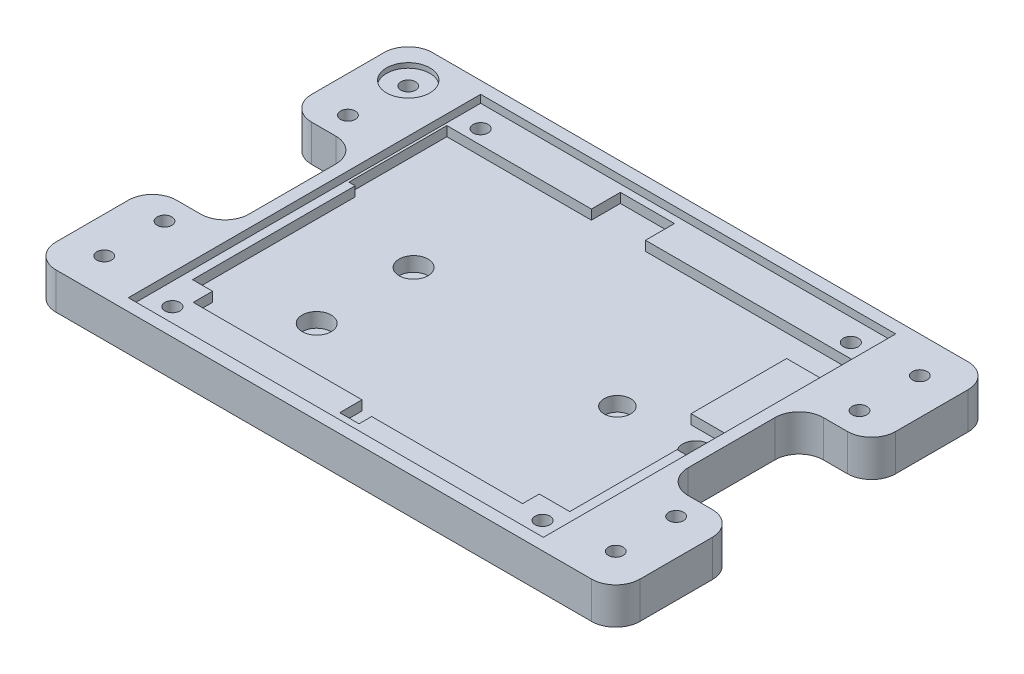
from build123d import *

# Parameters (mm, degrees)
BOSS_EXTRUDE1_DEPTH = 7.6
SKETCH2_5_W         = 85
SKETCH2_5_H         = 72
CUT_EXTRUDE9_DEPTH  = 1.61
CUT_EXTRUDE10_DEPTH = 2
SKETCH2_R           = 1.55
CUT_EXTRUDE3_DEPTH  = 90.547849587
FILLET1_R           = 5
SKETCH5_R           = 1.525
CUT_EXTRUDE4_DEPTH  = 10
SKETCH5_3_R         = 4.5
CUT_EXTRUDE5_DEPTH  = 1
CUT_EXTRUDE6_DEPTH  = 2.4
SKETCH12_R          = 2.75
SKETCH12_R_2        = 3
CUT_EXTRUDE11_DEPTH = 5
SKETCH2_6_W         = 86
SKETCH2_6_H         = 73
CUT_EXTRUDE12_DEPTH = 1.61


with BuildPart() as part:
    # Sketch1 → Boss-Extrude1 (new body)
    with BuildSketch(Plane(origin=(0, 0, 0), x_dir=(1, 0, 0), z_dir=(0, 1, 0))):
        Polygon((-40.307015775, 35.377886591), (-40.307015775, 7.377886591), (-55.307015775, 7.377886591), (-55.307015775, -17.622113409), (-44.307015775, -17.622113409), (45.692984225, -17.622113409), (65.692984225, -17.622113409), (65.692984225, 7.377886591), (50.692984225, 7.377886591), (50.692984225, 35.377886591), (65.692984225, 35.377886591), (65.692984225, 60.377886591), (45.692984225, 60.377886591), (-44.307015775, 60.377886591), (-55.307015775, 60.377886591), (-55.307015775, 35.377886591), align=None)
    extrude(amount=BOSS_EXTRUDE1_DEPTH)

    # Sketch2<5> → Cut-Extrude9 (cut)
    with BuildSketch(Plane(origin=(0, 7.6, 0), x_dir=(1, 0, 0), z_dir=(0, 1, 0))):
        with Locations((5.192984225, 21.377886591)):
            Rectangle(SKETCH2_5_W, SKETCH2_5_H)
    extrude(amount=-CUT_EXTRUDE9_DEPTH, mode=Mode.SUBTRACT)

    # Sketch11 → Cut-Extrude10 (cut)
    with BuildSketch(Plane(origin=(0, 5.99, 0), x_dir=(1, 0, 0), z_dir=(0, 1, 0))):
        Polygon((-35.999166331, 50.377886591), (-7.351072422, 50.377886591), (-7.351072422, 56.377886591), (3.851672568, 56.377886591), (3.851672568, 50.377886591), (47.692984225, 50.377886591), (47.692984225, 43.777886591), (39.692984225, 43.777886591), (39.692984225, 23.977886591), (47.692984225, 23.977886591), (47.692984225, 16.077886591), (44.692984225, 16.077886591), (44.692984225, -6.156199895), (38.382984225, -6.156199895), (38.382984225, -9.622113409), (7.110984225, -9.622113409), (7.110984225, -12.237769432), (3.110984225, -12.237769432), (3.110984225, -7.622113409), (-31.857233389, -7.622113409), (-31.857233389, -3.622113409), (-35.999166331, -3.622113409), (-35.999166331, 30.077886591), (-37.307015775, 30.077886591), (-37.307015775, 50.377886591), align=None)
    extrude(amount=-CUT_EXTRUDE10_DEPTH, mode=Mode.SUBTRACT)

    # Sketch2 → Cut-Extrude3 (cut, through all)
    with BuildSketch(Plane(origin=(0, 7.6, 0), x_dir=(1, 0, 0), z_dir=(0, 1, 0))):
        with Locations((43.464984225, 53.313886591)):
            Circle(SKETCH2_R)
        with Locations((-33.243015775, 53.313886591)):
            Circle(SKETCH2_R)
        with Locations((-33.243015775, -10.558113409)):
            Circle(SKETCH2_R)
        with Locations((43.464984225, -10.558113409)):
            Circle(SKETCH2_R)
    extrude(amount=-CUT_EXTRUDE3_DEPTH, mode=Mode.SUBTRACT)

    # Fillet1
    fillet1_edges = [part.edges().sort_by_distance(p)[0] for p in [
        (-55.307015775, 3.8, -35.377886591),
        (-55.307015775, 3.8, -60.377886591),
        (-55.307015775, 3.8, 17.622113409),
        (65.692984225, 3.8, -60.377886591),
        (50.692984225, 3.8, -35.377886591),
        (65.692984225, 3.8, -35.377886591),
        (65.692984225, 3.8, 17.622113409),
        (-55.307015775, 3.8, -7.377886591),
        (65.692984225, 3.8, -7.377886591),
        (50.692984225, 3.8, -7.377886591),
        (-40.307015775, 3.8, -7.377886591),
        (-40.307015775, 3.8, -35.377886591),
    ]]
    fillet(fillet1_edges, radius=FILLET1_R)

    # Sketch5 → Cut-Extrude4 (cut)
    with BuildSketch(Plane(origin=(0, 7.6, 0), x_dir=(1, 0, 0), z_dir=(0, 1, 0))):
        with Locations((-47.807015775, 52.877886591)):
            Circle(SKETCH5_R)
        with Locations((-47.807015775, -10.122113409)):
            Circle(SKETCH5_R)
        with Locations((58.192984225, -10.122113409)):
            Circle(SKETCH5_R)
        with Locations((58.192984225, 52.877886591)):
            Circle(SKETCH5_R)
        with Locations((-47.807015775, 40.377886591)):
            Circle(SKETCH5_R)
        with Locations((-47.807015775, 2.377886591)):
            Circle(SKETCH5_R)
        with Locations((58.192984225, 2.377886591)):
            Circle(SKETCH5_R)
        with Locations((58.192984225, 40.377886591)):
            Circle(SKETCH5_R)
    extrude(amount=-CUT_EXTRUDE4_DEPTH, mode=Mode.SUBTRACT)

    # Sketch5<3> → Cut-Extrude5 (cut)
    with BuildSketch(Plane(origin=(0, 7.6, 0), x_dir=(1, 0, 0), z_dir=(0, 1, 0))):
        with Locations((-47.807015775, 52.877886591)):
            Circle(SKETCH5_3_R)
    extrude(amount=-CUT_EXTRUDE5_DEPTH, mode=Mode.SUBTRACT)

    # Sketch6 → Cut-Extrude6 (cut)
    with BuildSketch(Plane.XZ):
        Polygon((-48.06313711, 6.92807179), (-45.16895526, 8.303285016), (-44.912833924, 11.497326635), (-47.550894439, 13.316155027), (-50.445076289, 11.940941801), (-50.701197625, 8.746900183), align=None)
        Polygon((57.994664168, 6.923962513), (60.863504118, 8.351287753), (61.061824175, 11.549438649), (58.391304282, 13.320264305), (55.522464333, 11.892939064), (55.324144276, 8.694788168), align=None)
        Polygon((60.566668821, -50.725417907), (57.515733962, -49.745981088), (55.142049366, -51.898449773), (55.819299629, -55.030355276), (58.870234489, -56.009792094), (61.243919085, -53.85732341), align=None)
        Polygon((-51.011308362, -52.874883962), (-49.411762421, -55.651384058), (-46.207469834, -55.654386687), (-44.602723187, -52.88088922), (-46.202269128, -50.104389124), (-49.406561715, -50.101386495), align=None)
        Polygon((-36.168627764, 11.865130811), (-35.837732042, 8.677967805), (-32.912120053, 7.370950404), (-30.317403786, 9.251096007), (-30.648299507, 12.438259012), (-33.573911496, 13.745276414), align=None)
        Polygon((40.267307985, 10.763945049), (41.687890676, 7.891760372), (44.885566916, 7.685928731), (46.662660465, 10.352281768), (45.242077775, 13.224466445), (42.044401535, 13.430298086), align=None)
        Polygon((40.985735994, -55.343868908), (43.983376365, -56.4759697), (46.462624597, -54.445987383), (45.944232457, -51.283904274), (42.946592085, -50.151803482), (40.467343854, -52.181785799), align=None)
        Polygon((-36.426218549, -53.680928955), (-34.51674915, -56.254142241), (-31.333546376, -55.887099877), (-30.059813, -52.946844227), (-31.969282399, -50.373630941), (-35.152485173, -50.740673305), align=None)
    extrude(amount=-CUT_EXTRUDE6_DEPTH, mode=Mode.SUBTRACT)

    # Sketch12 → Cut-Extrude11 (cut)
    with BuildSketch(Plane(origin=(0, 5.99, 0), x_dir=(1, 0, 0), z_dir=(0, 1, 0))):
        with Locations((28.732984225, 19.667886591)):
            Circle(SKETCH12_R)
        with Locations((44.992984225, 19.667886591)):
            Circle(SKETCH12_R)
        with Locations((-17.305374837, 3.407886591)):
            Circle(SKETCH12_R_2)
        with Locations((-17.305374837, 23.477886591)):
            Circle(SKETCH12_R_2)
    extrude(amount=-CUT_EXTRUDE11_DEPTH, mode=Mode.SUBTRACT)

    # Sketch2<6> → Cut-Extrude12 (cut)
    with BuildSketch(Plane(origin=(0, 7.6, 0), x_dir=(1, 0, 0), z_dir=(0, 1, 0))):
        with Locations((5.192984225, 21.377886591)):
            Rectangle(SKETCH2_6_W, SKETCH2_6_H)
    extrude(amount=-CUT_EXTRUDE12_DEPTH, mode=Mode.SUBTRACT)


solid = part.part
